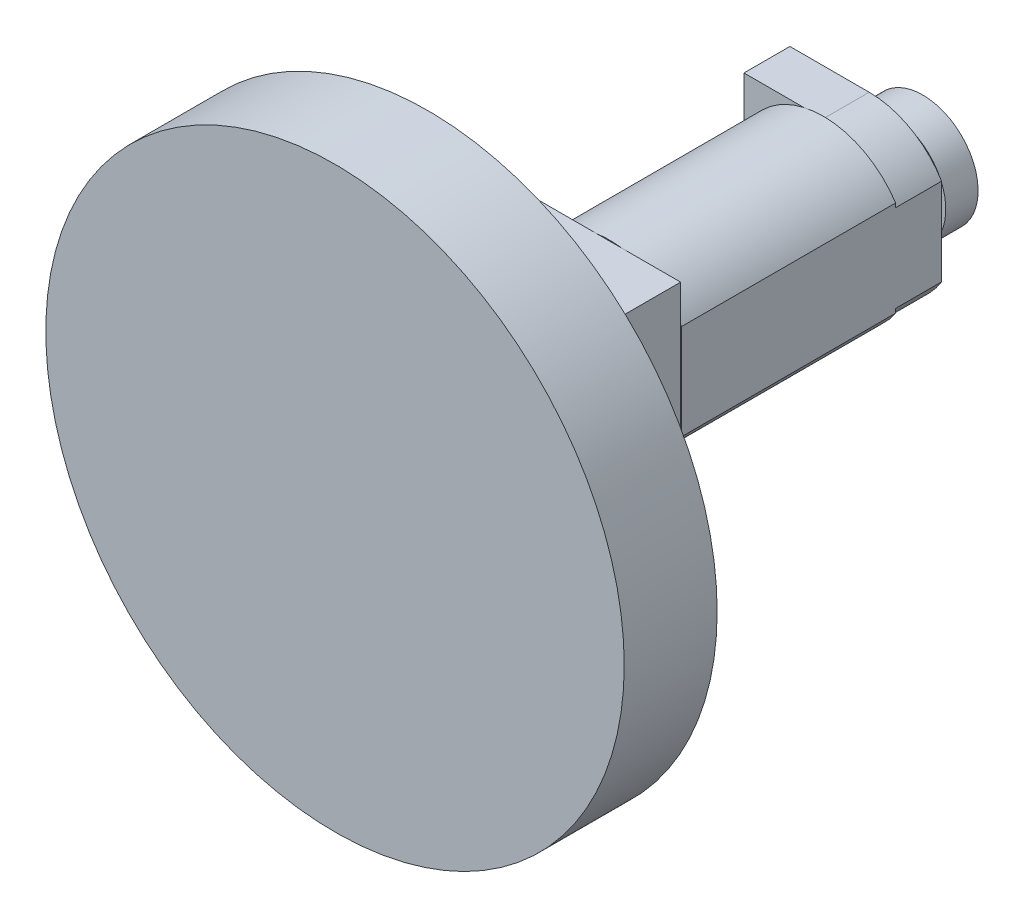
from build123d import *

# Parameters (mm, degrees)
BOSS_EXTRUDE1_DEPTH = 14.8082
SKETCH2_W           = 9.8806
SKETCH2_H           = 11.8618
BOSS_EXTRUDE2_DEPTH = 9.017
BOSS_EXTRUDE3_DEPTH = 9.9441
BOSS_EXTRUDE4_START = -6.4262
SKETCH4_R           = 20.0025
BOSS_EXTRUDE4_DEPTH = 6.4262
BOSS_EXTRUDE5_DEPTH = 3.175
SKETCH7_R           = 0.254
BOSS_EXTRUDE6_DEPTH = 1.4732
SKETCH8_R           = 3.8227
BOSS_EXTRUDE7_DEPTH = 2.2352


with BuildPart() as part:
    # Sketch1 → Boss-Extrude1 (new body)
    with BuildSketch(Plane.XY):
        with BuildLine():
            Line((-5.0038, 3.300729756), (-5.0038, -3.300729756))
            ThreePointArc((-5.0038, -3.300729756), (0, -5.9944), (5.0038, -3.300729756))
            Line((5.0038, -3.300729756), (5.0038, 3.300729756))
            ThreePointArc((5.0038, 3.300729756), (0, 5.9944), (-5.0038, 3.300729756))
        make_face()
    extrude(amount=BOSS_EXTRUDE1_DEPTH)

    # Sketch2 → Boss-Extrude2 (add)
    with BuildSketch(Plane.XY.offset(14.8082)):
        Rectangle(SKETCH2_W, SKETCH2_H)
    extrude(amount=BOSS_EXTRUDE2_DEPTH)

    # Sketch3 → Boss-Extrude3 (add)
    with BuildSketch(Plane.XY.offset(23.8252)):
        with BuildLine():
            Line((-1.112972237, -0.9652), (1.112972237, -0.9652))
            ThreePointArc((1.112972237, -0.9652), (0, 1.4732), (-1.112972237, -0.9652))
        make_face()
    extrude(amount=BOSS_EXTRUDE3_DEPTH)

    # Sketch4 → Boss-Extrude4 (add)
    with BuildSketch(Plane.XY.offset(33.7693).offset(BOSS_EXTRUDE4_START)):
        Circle(SKETCH4_R)
        with BuildLine():
            Line((-1.112972237, -0.9652), (1.112972237, -0.9652))
            ThreePointArc((1.112972237, -0.9652), (0, 1.4732), (-1.112972237, -0.9652))
        make_face(mode=Mode.SUBTRACT)
    extrude(amount=BOSS_EXTRUDE4_DEPTH)

    # Sketch5 → Boss-Extrude5 (add)
    with BuildSketch(Plane(origin=(0, 0, 0), x_dir=(-1, 0, 0), z_dir=(0, 0, -1))):
        with BuildLine():
            Line((0, -5.842), (5.4864, -5.842))
            Line((5.4864, -5.842), (5.4864, 5.842))
            Line((5.4864, 5.842), (0, 5.842))
            ThreePointArc((0, 5.842), (-2.873554597, 5.086417991), (-5.0038, 3.015120157))
            Line((-5.0038, 3.015120157), (-5.0038, -3.015120157))
            ThreePointArc((-5.0038, -3.015120157), (-2.873554597, -5.086417991), (0, -5.842))
        make_face()
    extrude(amount=BOSS_EXTRUDE5_DEPTH)

    # Sketch7 → Boss-Extrude6 (add)
    with BuildSketch(Plane(origin=(0, 0, -3.175), x_dir=(-1, 0, 0), z_dir=(0, 0, -1))):
        Circle(SKETCH7_R)
    extrude(amount=BOSS_EXTRUDE6_DEPTH)

    # Sketch8 → Boss-Extrude7 (add)
    with BuildSketch(Plane(origin=(0, 0, -4.6482), x_dir=(-1, 0, 0), z_dir=(0, 0, -1))):
        Circle(SKETCH8_R)
    extrude(amount=BOSS_EXTRUDE7_DEPTH)


solid = part.part
